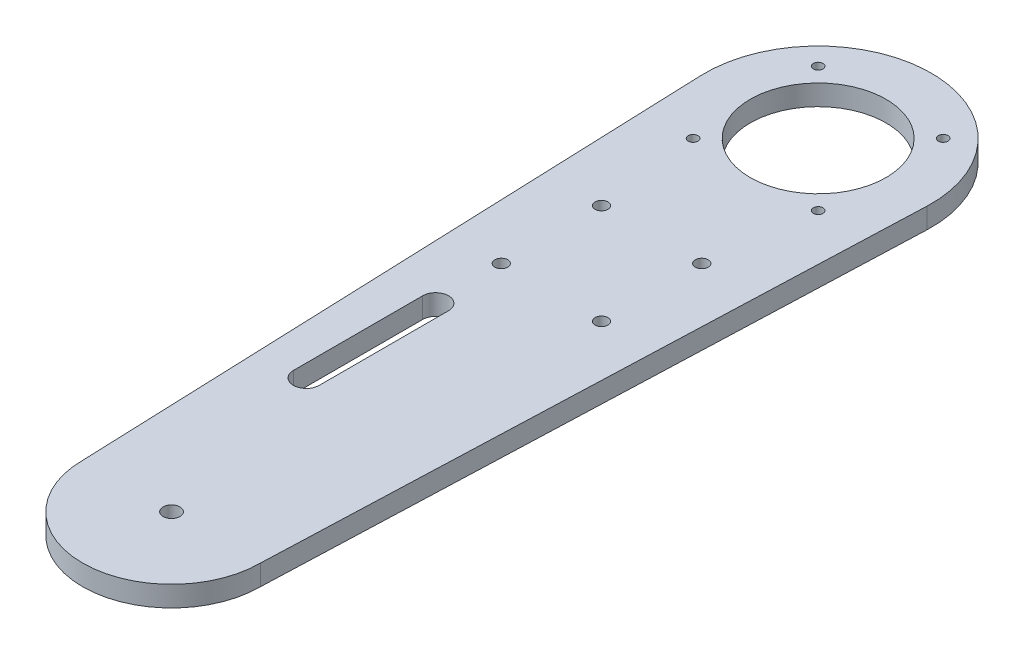
from build123d import *

# Parameters (mm, degrees)
BOSS_EXTRUDE1_DEPTH     = 6.35
SKETCH2_R               = 2.6
CUT_EXTRUDE1_DEPTH      = 238.676928834
ESQUISSE3_R             = 21
ENL_V_MAT_EXTRU_2_DEPTH = 238.676928834
ESQUISSE7_R             = 1.5
ENL_V_MAT_EXTRU_3_DEPTH = 238.676928834
CUT_EXTRUDE3_DEPTH      = 238.676928834
SKETCH5_R               = 2
CUT_EXTRUDE4_DEPTH      = 238.676928834


with BuildPart() as part:
    # Sketch1 → Boss-Extrude1 (new body)
    with BuildSketch(Plane(origin=(0, 0, 0), x_dir=(1, 0, 0), z_dir=(0, 1, 0))):
        with BuildLine():
            Line((27.5, 0), (34.975254116, 198.684097441))
            ThreePointArc((34.975254116, 198.684097441), (0, 235), (-34.975254116, 198.684097441))
            Line((-34.975254116, 198.684097441), (-27.5, 0))
            ThreePointArc((-27.5, 0), (0, -27.5), (27.5, 0))
        make_face()
    extrude(amount=BOSS_EXTRUDE1_DEPTH)

    # Sketch2 → Cut-Extrude1 (cut, through all)
    with BuildSketch(Plane(origin=(0, 6.35, 0), x_dir=(1, 0, 0), z_dir=(0, 1, 0))):
        with Locations(Location((0, 0, 0), (0, 0, 270))):
            Circle(SKETCH2_R)
    extrude(amount=-CUT_EXTRUDE1_DEPTH, mode=Mode.SUBTRACT)

    # Esquisse3 → Enlèv. mat.-Extru.2 (cut, through all)
    with BuildSketch(Plane(origin=(0, 6.35, 0), x_dir=(1, 0, 0), z_dir=(0, 1, 0))):
        with Locations(Location((0, 200, 0), (0, 0, 270))):
            Circle(ESQUISSE3_R)
    extrude(amount=-ENL_V_MAT_EXTRU_2_DEPTH, mode=Mode.SUBTRACT)

    # Esquisse7 → Enlèv. mat.-Extru.3 (cut, through all)
    with BuildSketch(Plane(origin=(0, 6.35, 0), x_dir=(1, 0, 0), z_dir=(0, 1, 0))):
        with Locations(Location((-19.339370465, 219.339370465, 0), (0, 0, 270))):
            Circle(ESQUISSE7_R)
        with Locations(Location((19.339370465, 219.339370465, 0), (0, 0, 270))):
            Circle(ESQUISSE7_R)
        with Locations(Location((19.339370465, 180.660629535, 0), (0, 0, 270))):
            Circle(ESQUISSE7_R)
        with Locations(Location((-19.339370465, 180.660629535, 0), (0, 0, 270))):
            Circle(ESQUISSE7_R)
    extrude(amount=-ENL_V_MAT_EXTRU_3_DEPTH, mode=Mode.SUBTRACT)

    # Sketch4 → Cut-Extrude3 (cut, through all)
    with BuildSketch(Plane(origin=(0, 6.35, 0), x_dir=(1, 0, 0), z_dir=(0, 1, 0))):
        with BuildLine():
            Line((-19, 56.7), (-19, 96.7))
            ThreePointArc((-19, 96.7), (-15, 100.7), (-11, 96.7))
            Line((-11, 96.7), (-11, 56.7))
            ThreePointArc((-11, 56.7), (-15, 52.7), (-19, 56.7))
        make_face()
    extrude(amount=-CUT_EXTRUDE3_DEPTH, mode=Mode.SUBTRACT)

    # Sketch5 → Cut-Extrude4 (cut, through all)
    with BuildSketch(Plane.XZ):
        with Locations(Location((15.5, -117.5, 0), (0, 0, 270))):
            Circle(SKETCH5_R)
        with Locations(Location((15.5, -148.5, 0), (0, 0, 270))):
            Circle(SKETCH5_R)
        with Locations(Location((-15.5, -148.5, 0), (0, 0, 270))):
            Circle(SKETCH5_R)
        with Locations(Location((-15.5, -117.5, 0), (0, 0, 270))):
            Circle(SKETCH5_R)
    extrude(amount=-CUT_EXTRUDE4_DEPTH, mode=Mode.SUBTRACT)


solid = part.part
